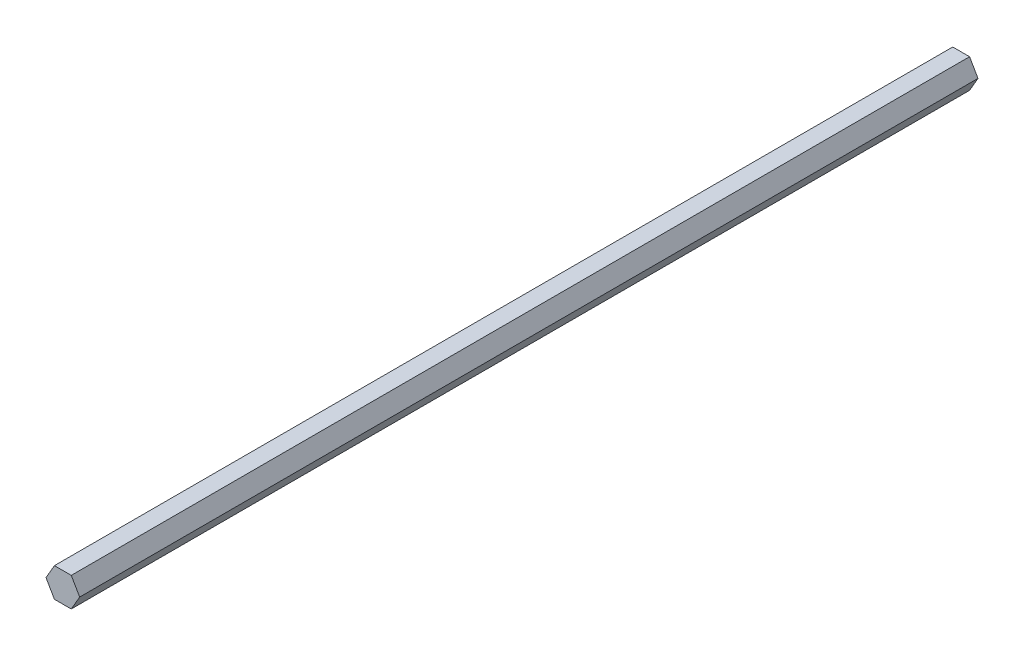
from build123d import *

# Parameters (mm, degrees)
BOSS_EXTRUDE1_DEPTH = 391.16


with BuildPart() as part:
    # Sketch1 → Boss-Extrude1 (new body)
    with BuildSketch(Plane.XY):
        Polygon((7.332348419, 0), (3.666174209, 6.35), (-3.666174209, 6.35), (-7.332348419, 0), (-3.666174209, -6.35), (3.666174209, -6.35), align=None)
    extrude(amount=BOSS_EXTRUDE1_DEPTH)


solid = part.part
